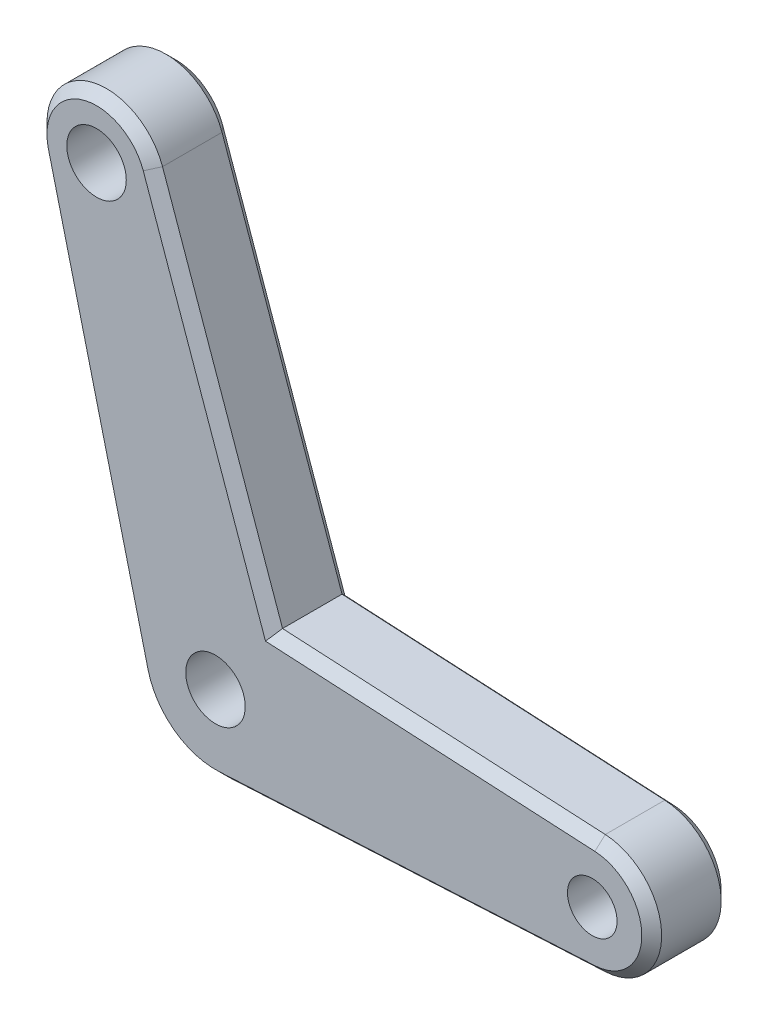
from build123d import *

# Parameters (mm, degrees)
CROQUIS7_R              = 3
CROQUIS7_R_2            = 1.5
SALIENTE_EXTRUIR4_DEPTH = 4
CROQUIS9_R              = 1.5
CROQUIS9_R_2            = 1.25
SALIENTE_EXTRUIR5_DEPTH = 4
CROQUIS2_R              = 3.020046414
CROQUIS2_R_2            = 1.5
SALIENTE_EXTRUIR2_DEPTH = 4
CHAFL_N1_SIZE           = 0.5


with BuildPart() as part:
    # Croquis7 → Saliente-Extruir4 (new body)
    with BuildSketch(Plane.XY):
        Circle(CROQUIS7_R)
        Circle(CROQUIS7_R_2, mode=Mode.SUBTRACT)
    extrude(amount=-SALIENTE_EXTRUIR4_DEPTH)

    # Croquis9 → Saliente-Extruir5 (add)
    with BuildSketch(Plane.XY):
        with BuildLine():
            Line((0.210526316, 3.994455992), (19.157894737, 2.995841994))
            ThreePointArc((19.157894737, 2.995841994), (22, 0), (19.157894737, -2.995841994))
            Line((19.157894737, -2.995841994), (0.210526316, -3.994455992))
            ThreePointArc((0.210526316, -3.994455992), (-4, 0), (0.210526316, 3.994455992))
        make_face()
        Circle(CROQUIS9_R, mode=Mode.SUBTRACT)
        with Locations((19, 0)):
            Circle(CROQUIS9_R_2, mode=Mode.SUBTRACT)
    extrude(amount=-SALIENTE_EXTRUIR5_DEPTH)

    # Croquis2 → Saliente-Extruir2 (add, through all)
    with BuildSketch(Plane.XY.offset(-4)):
        with BuildLine():
            Line((-3.171102714, 20.998669186), (3.771863049, 1.331558915))
            ThreePointArc((3.771863049, 1.331558915), (1.149391542, -3.831305141), (-3.881954792, -0.964586438))
            Line((-3.881954792, -0.964586438), (-8.911466094, 19.276560172))
            ThreePointArc((-8.911466094, 19.276560172), (-6.862043657, 22.873478856), (-3.171102714, 20.998669186))
        make_face()
        Circle(CROQUIS2_R, mode=Mode.SUBTRACT)
        with Locations((-6, 20)):
            Circle(CROQUIS2_R_2, mode=Mode.SUBTRACT)
    extrude(amount=SALIENTE_EXTRUIR2_DEPTH)

    # Chaflán1
    chafl_n1_edges = [part.edges().sort_by_distance(p)[0] for p in [
        (11.01969335, 3.424762868, -4),
        (22, 0, -4),
        (9.684210526, -3.495148993, -4),
        (9.684210526, -3.495148993, 0),
        (22, 0, 0),
        (11.01969335, 3.424762868, 0),
        (-2.380099608, -3.214829056, 0),
        (-2.380099608, -3.214829056, -4),
        (-6.396710443, 9.155986867, 0),
        (-0.144805375, 12.426176464, 0),
        (-6.862043657, 22.873478856, 0),
        (-6.862043657, 22.873478856, -4),
        (-6.396710443, 9.155986867, -4),
        (-0.144805375, 12.426176464, -4),
    ]]
    chamfer(chafl_n1_edges, length=CHAFL_N1_SIZE)


solid = part.part
